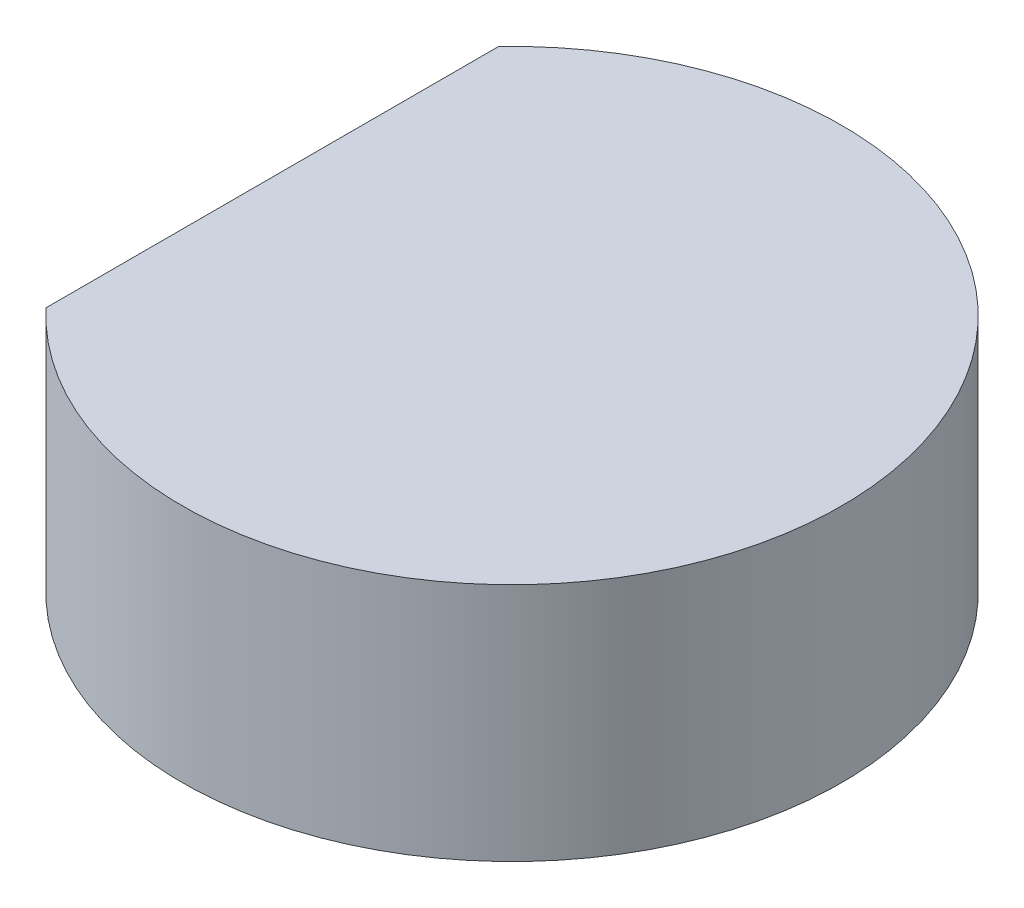
from build123d import *

# Parameters (mm, degrees)
SKETCH1_R           = 6.985
BOSS_EXTRUDE1_DEPTH = 5.08
SKETCH4_W           = 3.81
SKETCH4_H           = 12.7
CUT_EXTRUDE1_DEPTH  = 12.10796336


with BuildPart() as part:
    # Sketch1 → Boss-Extrude1 (new body)
    with BuildSketch(Plane(origin=(0, 0, 0), x_dir=(1, 0, 0), z_dir=(0, 1, 0))):
        with Locations(Location((0, 0, 0), (0, 0, 270))):
            Circle(SKETCH1_R)
    extrude(amount=BOSS_EXTRUDE1_DEPTH)

    # Sketch4 → Cut-Extrude1 (cut, through all)
    with BuildSketch(Plane(origin=(0, 5.08, 0), x_dir=(1, 0, 0), z_dir=(0, 1, 0))):
        with Locations((-6.985, 0)):
            Rectangle(SKETCH4_W, SKETCH4_H)
    extrude(amount=-CUT_EXTRUDE1_DEPTH, mode=Mode.SUBTRACT)


solid = part.part
